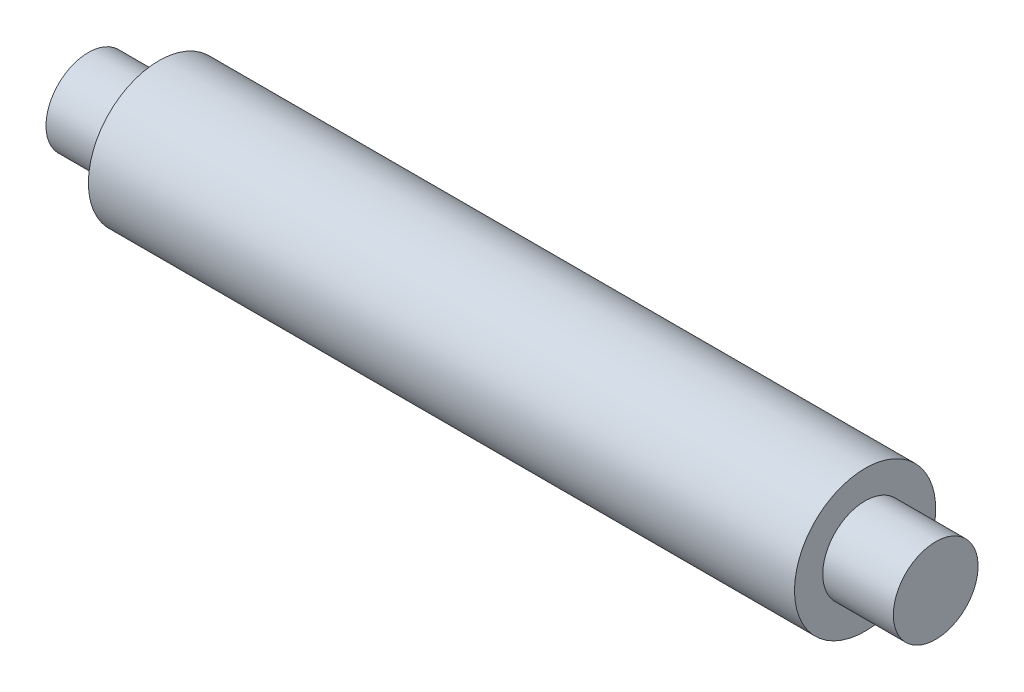
from build123d import *

# Parameters (mm, degrees)
SKETCH_1_W = 10
SKETCH_1_H = 6


with BuildPart() as part:
    # 草圖1 → 旋轉1 (revolve)
    with BuildSketch(Plane.XY, mode=Mode.PRIVATE) as revolve_1_sk:
        Polygon((10, 6), (10, 0), (110, 0), (110, 6), (110, 10), (10, 10), align=None)
        with Locations((115, 3)):
            Rectangle(SKETCH_1_W, SKETCH_1_H)
        with Locations((5, 3)):
            Rectangle(SKETCH_1_W, SKETCH_1_H)
    revolve(revolve_1_sk.sketch.rotate(Axis((0, 0, 0), (1, 0, 0)), 90), axis=Axis((0, 0, 0), (1, 0, 0)))


solid = part.part
